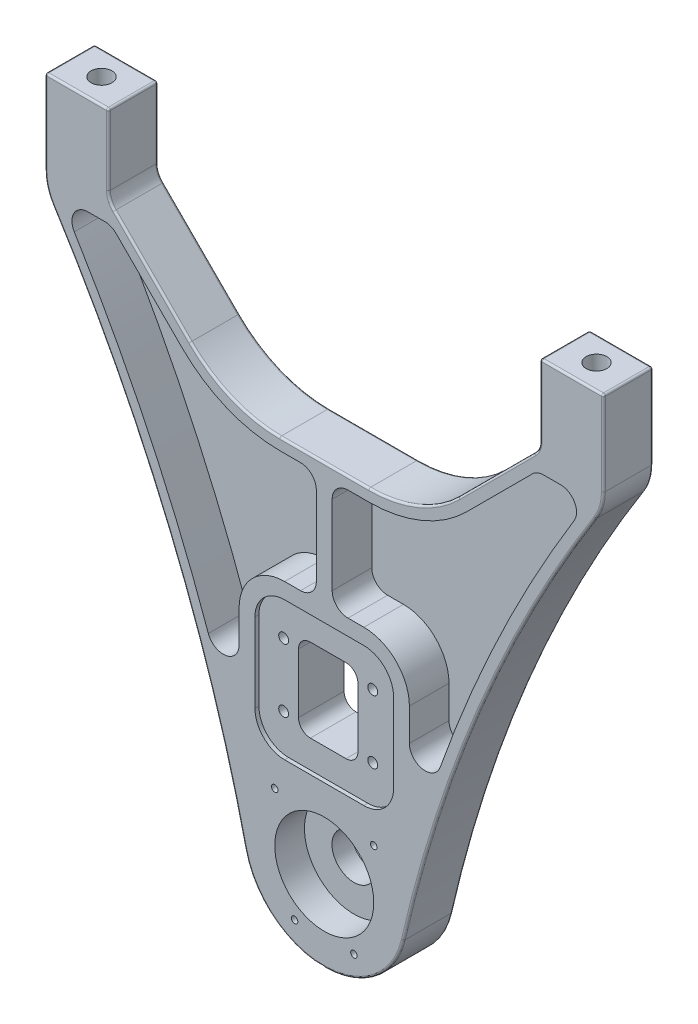
from build123d import *

# Parameters (mm, degrees)
BOSS_EXTRUDE1_DEPTH        = 25
SKETCH2_R                  = 25
CUT_EXTRUDE1_DEPTH         = 15
CUT_EXTRUDE3_DEPTH         = 2
CUT_EXTRUDE4_DEPTH         = 20
FILLET1_R                  = 1
SKETCH3_R                  = 11.1125
CUT_EXTRUDE2_DEPTH         = 19.05
CUT_EXTRUDE6_DEPTH         = 315.340579634
M12X1_5_TAPPED_HOLE1_D     = 10.5
M12X1_5_TAPPED_HOLE1_DEPTH = 31.5
M12X1_5_TAPPED_HOLE1_TIP   = 3.15451825
M4X0_7_TAPPED_HOLE1_D      = 3.3
M4X0_7_TAPPED_HOLE1_DEPTH  = 11.5
M4X0_7_TAPPED_HOLE1_TIP    = 0.991420021
M6X1_0_TAPPED_HOLE1_D      = 5
M6X1_0_TAPPED_HOLE1_DEPTH  = 17
M6X1_0_TAPPED_HOLE1_TIP    = 1.502151548
SKETCH24_W                 = 0.2
SKETCH24_H                 = 1.204653058
CUT_EXTRUDE7_DEPTH         = 3


with BuildPart() as part:
    # Sketch1 → Boss-Extrude1 (new body)
    with BuildSketch(Plane.XY):
        with BuildLine():
            Line((109, 280), (141, 280))
            Line((141, 280), (141, 237.308754644))
            ThreePointArc((141, 237.308754644), (140.012193642, 230.350697696), (137.12683548, 223.942497778))
            ThreePointArc((137.12683548, 223.942497778), (78.660042714, 111.502319563), (39.959807706, -9.176805987))
            ThreePointArc((39.959807706, -9.176805987), (0, -41), (-39.959807706, -9.176805987))
            ThreePointArc((-39.959807706, -9.176805987), (-78.660042714, 111.502319563), (-137.12683548, 223.942497778))
            ThreePointArc((-137.12683548, 223.942497778), (-140.012193642, 230.350697696), (-141, 237.308754644))
            Line((-141, 237.308754644), (-141, 280))
            Line((-141, 280), (-109, 280))
            Line((-109, 280), (-109, 244.142135624))
            ThreePointArc((-109, 244.142135624), (-108.238795325, 240.3153013), (-106.071067812, 237.071067812))
            Line((-106.071067812, 237.071067812), (-67.745166004, 198.745166004))
            ThreePointArc((-67.745166004, 198.745166004), (-46.982071679, 184.871709919), (-22.490332008, 180))
            Line((-22.490332008, 180), (22.490332008, 180))
            ThreePointArc((22.490332008, 180), (46.982071679, 184.871709919), (67.745166004, 198.745166004))
            Line((67.745166004, 198.745166004), (106.071067812, 237.071067812))
            ThreePointArc((106.071067812, 237.071067812), (108.238795325, 240.3153013), (109, 244.142135624))
            Line((109, 244.142135624), (109, 280))
        make_face()
    extrude(amount=BOSS_EXTRUDE1_DEPTH)

    # Sketch2 → Cut-Extrude1 (cut)
    with BuildSketch(Plane.XY.offset(25)):
        Circle(SKETCH2_R)
    extrude(amount=-CUT_EXTRUDE1_DEPTH, mode=Mode.SUBTRACT)

    # Sketch4 → Cut-Extrude3 (cut)
    with BuildSketch(Plane.XY.offset(25)):
        with BuildLine():
            Line((-20, 40), (20, 40))
            ThreePointArc((20, 40), (30.606601718, 44.393398282), (35, 55))
            Line((35, 55), (35, 95))
            ThreePointArc((35, 95), (30.606601718, 105.606601718), (20, 110))
            Line((20, 110), (-20, 110))
            ThreePointArc((-20, 110), (-30.606601718, 105.606601718), (-35, 95))
            Line((-35, 95), (-35, 55))
            ThreePointArc((-35, 55), (-30.606601718, 44.393398282), (-20, 40))
        make_face()
    extrude(amount=-CUT_EXTRUDE3_DEPTH, mode=Mode.SUBTRACT)

    # Sketch5 → Cut-Extrude4 (cut)
    with BuildSketch(Plane.XY.offset(25)):
        with BuildLine():
            Line((22.490332008, 174), (12, 174))
            ThreePointArc((12, 174), (6.343145751, 171.656854249), (4, 166))
            Line((4, 166), (4, 126))
            ThreePointArc((4, 126), (6.343145751, 120.343145751), (12, 118))
            Line((12, 118), (20, 118))
            ThreePointArc((20, 118), (36.263455967, 111.263455967), (43, 95))
            Line((43, 95), (43, 78.677414062))
            ThreePointArc((43, 78.677414062), (49.641403556, 70.793619563), (58.538553925, 75.999690268))
            ThreePointArc((58.538553925, 75.999690268), (88.698463192, 148.674821685), (126.248822694, 217.821516145))
            ThreePointArc((126.248822694, 217.821516145), (126.406316455, 225.909739707), (119.426779549, 230))
            Line((119.426779549, 230), (110.798989873, 230))
            ThreePointArc((110.798989873, 230), (107.737522414, 229.39103626), (105.142135624, 227.656854249))
            Line((105.142135624, 227.656854249), (71.987806691, 194.502525317))
            ThreePointArc((71.987806691, 194.502525317), (49.278172274, 179.328432724), (22.490332008, 174))
        make_face()
        with BuildLine():
            Line((-43, 95), (-43, 78.677414062))
            ThreePointArc((-43, 78.677414062), (-49.641403556, 70.793619563), (-58.538553925, 75.999690268))
            ThreePointArc((-58.538553925, 75.999690268), (-88.698463192, 148.674821685), (-126.248822694, 217.821516145))
            ThreePointArc((-126.248822694, 217.821516145), (-126.406316455, 225.909739707), (-119.426779549, 230))
            Line((-119.426779549, 230), (-110.798989873, 230))
            ThreePointArc((-110.798989873, 230), (-107.737522414, 229.39103626), (-105.142135624, 227.656854249))
            Line((-105.142135624, 227.656854249), (-71.987806691, 194.502525317))
            ThreePointArc((-71.987806691, 194.502525317), (-49.278172274, 179.328432724), (-22.490332008, 174))
            Line((-22.490332008, 174), (-12, 174))
            ThreePointArc((-12, 174), (-6.343145751, 171.656854249), (-4, 166))
            Line((-4, 166), (-4, 126))
            ThreePointArc((-4, 126), (-6.343145751, 120.343145751), (-12, 118))
            Line((-12, 118), (-20, 118))
            ThreePointArc((-20, 118), (-36.263455967, 111.263455967), (-43, 95))
        make_face()
    extrude(amount=-CUT_EXTRUDE4_DEPTH, mode=Mode.SUBTRACT)

    # Fillet1
    fillet1_edges = [part.edges().sort_by_distance(p)[0] for p in [
        (-140.012193642, 230.350697696, 25),
        (-141, 258.654377322, 25),
        (-125, 280, 25),
        (-109, 262.071067812, 25),
        (-108.238795325, 240.3153013, 25),
        (-86.908116908, 217.908116908, 25),
        (-46.982071679, 184.871709919, 25),
        (0, 180, 25),
        (46.982071679, 184.871709919, 25),
        (86.908116908, 217.908116908, 25),
        (108.238795325, 240.3153013, 25),
        (109, 262.071067812, 25),
        (125, 280, 25),
        (141, 258.654377322, 25),
        (140.012193642, 230.350697696, 25),
        (78.660042714, 111.502319563, 25),
        (0, -41, 25),
        (-78.660042714, 111.502319563, 25),
        (0, -41, 0),
        (78.660042714, 111.502319563, 0),
        (140.012193642, 230.350697696, 0),
        (141, 258.654377322, 0),
        (125, 280, 0),
        (109, 262.071067812, 0),
        (108.238795325, 240.3153013, 0),
        (86.908116908, 217.908116908, 0),
        (46.982071679, 184.871709919, 0),
        (0, 180, 0),
        (-46.982071679, 184.871709919, 0),
        (-86.908116908, 217.908116908, 0),
        (-108.238795325, 240.3153013, 0),
        (-109, 262.071067812, 0),
        (-125, 280, 0),
        (-141, 258.654377322, 0),
        (-140.012193642, 230.350697696, 0),
        (-78.660042714, 111.502319563, 0),
        (141, 280, 12.5),
        (109, 280, 12.5),
        (-109, 280, 12.5),
        (-141, 280, 12.5),
    ]]
    fillet(fillet1_edges, radius=FILLET1_R)

    # Sketch3 → Cut-Extrude2 (cut)
    with BuildSketch(Plane.XY.offset(10)):
        Circle(SKETCH3_R)
    extrude(amount=-CUT_EXTRUDE2_DEPTH, mode=Mode.SUBTRACT)

    # Sketch10 → Cut-Extrude6 (cut, through all)
    with BuildSketch(Plane.XY.offset(23)):
        with BuildLine():
            Line((15, 60), (15, 90))
            ThreePointArc((15, 90), (13.242640687, 94.242640687), (9, 96))
            Line((9, 96), (-9, 96))
            ThreePointArc((-9, 96), (-13.242640687, 94.242640687), (-15, 90))
            Line((-15, 90), (-15, 60))
            ThreePointArc((-15, 60), (-13.242640687, 55.757359313), (-9, 54))
            Line((-9, 54), (9, 54))
            ThreePointArc((9, 54), (13.242640687, 55.757359313), (15, 60))
        make_face()
    extrude(amount=-CUT_EXTRUDE6_DEPTH, mode=Mode.SUBTRACT)

    # M12x1.5 Tapped Hole1
    with Locations(Plane(origin=(0, 280, 0), x_dir=(1, 0, 0), z_dir=(0, 1, 0))):
        with Locations((-125, -12.5), (125, -12.5)):
            Hole(M12X1_5_TAPPED_HOLE1_D / 2, depth=M12X1_5_TAPPED_HOLE1_DEPTH)
            with Locations((0, 0, -(M12X1_5_TAPPED_HOLE1_DEPTH + M12X1_5_TAPPED_HOLE1_TIP / 2))):  # 118° drill point
                Cone(0, M12X1_5_TAPPED_HOLE1_D / 2, M12X1_5_TAPPED_HOLE1_TIP, mode=Mode.SUBTRACT)

    # M4x0.7 Tapped Hole1
    with Locations(Plane.XY.offset(25)):
        with Locations((-15, -27.5), (25, 25), (-25, 25), (15, -27.5)):
            Hole(M4X0_7_TAPPED_HOLE1_D / 2, depth=M4X0_7_TAPPED_HOLE1_DEPTH)
            with Locations((0, 0, -(M4X0_7_TAPPED_HOLE1_DEPTH + M4X0_7_TAPPED_HOLE1_TIP / 2))):  # 118° drill point
                Cone(0, M4X0_7_TAPPED_HOLE1_D / 2, M4X0_7_TAPPED_HOLE1_TIP, mode=Mode.SUBTRACT)

    # M6x1.0 Tapped Hole1
    with Locations(Plane.XY.offset(23)):
        with Locations((-22.5, 59), (-22.5, 91), (22.5, 91), (22.5, 59)):
            Hole(M6X1_0_TAPPED_HOLE1_D / 2, depth=M6X1_0_TAPPED_HOLE1_DEPTH)
            with Locations((0, 0, -(M6X1_0_TAPPED_HOLE1_DEPTH + M6X1_0_TAPPED_HOLE1_TIP / 2))):  # 118° drill point
                Cone(0, M6X1_0_TAPPED_HOLE1_D / 2, M6X1_0_TAPPED_HOLE1_TIP, mode=Mode.SUBTRACT)

    # Sketch24 → Cut-Extrude7 (cut)
    with BuildSketch(Plane.XY.offset(25)):
        with Locations((0, -41.592326529)):
            Rectangle(SKETCH24_W, SKETCH24_H)
    extrude(amount=-CUT_EXTRUDE7_DEPTH, mode=Mode.SUBTRACT)


solid = part.part
